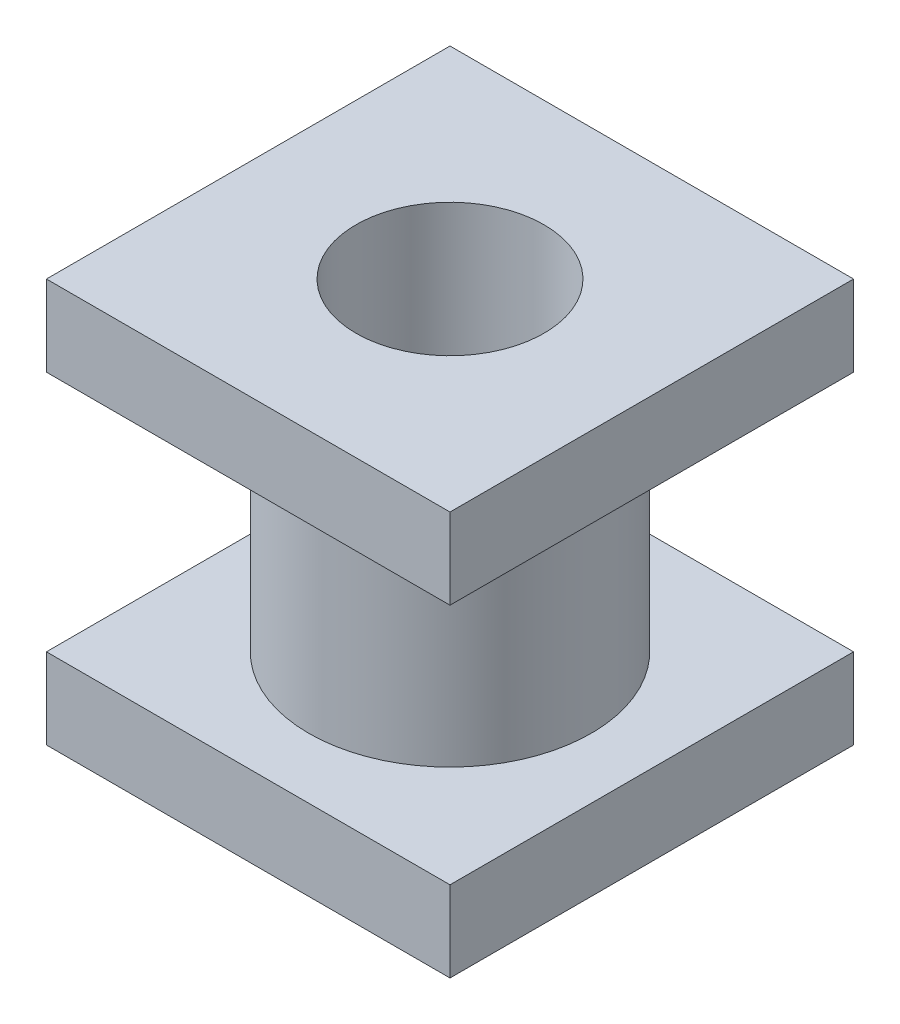
from build123d import *

# Parameters (mm, degrees)
SKETCH1_W           = 10
SKETCH1_H           = 10
SKETCH1_R           = 3.5
BOSS_EXTRUDE1_DEPTH = 2
SKETCH1_2_R         = 3.5
BOSS_EXTRUDE2_DEPTH = 10
BOSS_EXTRUDE4_START = 8
SKETCH1_4_W         = 10
SKETCH1_4_H         = 10
SKETCH1_4_R         = 3.5
BOSS_EXTRUDE4_DEPTH = 2
SKETCH2_R           = 2.330446687
CUT_EXTRUDE1_DEPTH  = 18.320508076


with BuildPart() as part:
    # Sketch1 → Boss-Extrude1 (new body)
    with BuildSketch(Plane(origin=(0, 0, 0), x_dir=(1, 0, 0), z_dir=(0, 1, 0))):
        with Locations((5, -5)):
            Rectangle(SKETCH1_W, SKETCH1_H)
        with Locations(Location((5, -5, 0), (0, 0, 270))):
            Circle(SKETCH1_R, mode=Mode.SUBTRACT)
    extrude(amount=BOSS_EXTRUDE1_DEPTH)

    # Sketch1<2> → Boss-Extrude2 (add)
    with BuildSketch(Plane(origin=(0, 0, 0), x_dir=(1, 0, 0), z_dir=(0, 1, 0))):
        with Locations(Location((5, -5, 0), (0, 0, 270))):
            Circle(SKETCH1_2_R)
    extrude(amount=BOSS_EXTRUDE2_DEPTH)

    # Sketch1<4> → Boss-Extrude4 (add)
    with BuildSketch(Plane(origin=(0, 0, 0), x_dir=(1, 0, 0), z_dir=(0, 1, 0)).offset(BOSS_EXTRUDE4_START)):
        with Locations((5, -5)):
            Rectangle(SKETCH1_4_W, SKETCH1_4_H)
        with Locations(Location((5, -5, 0), (0, 0, 270))):
            Circle(SKETCH1_4_R, mode=Mode.SUBTRACT)
    extrude(amount=BOSS_EXTRUDE4_DEPTH)

    # Sketch2 → Cut-Extrude1 (cut, through all)
    with BuildSketch(Plane(origin=(0, 10, 0), x_dir=(1, 0, 0), z_dir=(0, 1, 0))):
        with Locations(Location((5, -5, 0), (0, 0, 270))):
            Circle(SKETCH2_R)
    extrude(amount=-CUT_EXTRUDE1_DEPTH, mode=Mode.SUBTRACT)


solid = part.part
